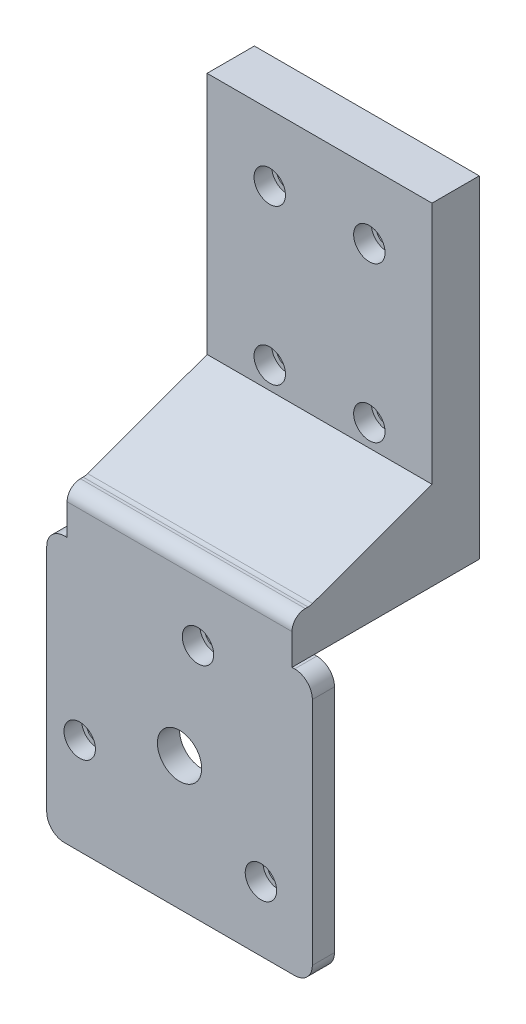
from build123d import *

# Parameters (mm, degrees)
SKETCH1_W           = 50.8
SKETCH1_H           = 65.000000038
SKETCH1_R           = 2.5
EXTRUDE_5_DEPTH     = 7.5
SKETCH1_3_W         = 50.8
SKETCH1_3_H         = 10
BOSS_EXTRUDE1_DEPTH = 34.125
BOSS_EXTRUDE2_START = 34.125
BOSS_EXTRUDE2_DEPTH = 5
CHAMFER1_SIZE       = 10
CHAMFER1_SIZE2      = 27.474774195
FILLET1_R           = 3
SKETCH2_R           = 5
CUT_EXTRUDE1_DEPTH  = 144.721138443
SKETCH3_R           = 2.5
CUT_EXTRUDE2_DEPTH  = 144.721138443
SKETCH4_R           = 3.55
CUT_EXTRUDE3_DEPTH  = 4
SKETCH5_R           = 3.55
CUT_EXTRUDE4_DEPTH  = 4
BOSS_EXTRUDE3_START = -3.18
SKETCH1_5_W         = 50.8
SKETCH1_5_H         = 10
SKETCH1_5_H_2       = 65.000000038
SKETCH1_5_R         = 2.5
BOSS_EXTRUDE3_DEPTH = 3.18


with BuildPart() as part:
    # Sketch1 → 5 (new body)
    with BuildSketch(Plane.XY):
        with Locations((0, 102.500000019)):
            Rectangle(SKETCH1_W, SKETCH1_H)
        with Locations((-11.25, 85.000000038)):
            Circle(SKETCH1_R, mode=Mode.SUBTRACT)
        with Locations((-11.25, 120.000000038)):
            Circle(SKETCH1_R, mode=Mode.SUBTRACT)
        with Locations((11.25, 85.000000038)):
            Circle(SKETCH1_R, mode=Mode.SUBTRACT)
        with Locations((11.25, 120.000000038)):
            Circle(SKETCH1_R, mode=Mode.SUBTRACT)
    extrude(amount=EXTRUDE_5_DEPTH)

    # Sketch1<3> → Boss-Extrude1 (add)
    with BuildSketch(Plane.XY):
        with Locations((0, 65)):
            Rectangle(SKETCH1_3_W, SKETCH1_3_H)
    extrude(amount=BOSS_EXTRUDE1_DEPTH)

    # Sketch1<4> → Boss-Extrude2 (add)
    with BuildSketch(Plane.XY.offset(BOSS_EXTRUDE2_START)):
        with BuildLine():
            Line((-25.4, 70), (-25.4, 60))
            Line((-25.4, 60), (-26, 60))
            ThreePointArc((-26, 60), (-28.828427125, 58.828427125), (-30, 56))
            Line((-30, 56), (-30, 4))
            ThreePointArc((-30, 4), (-28.828427125, 1.171572875), (-26, 0))
            Line((-26, 0), (26, 0))
            ThreePointArc((26, 0), (28.828427125, 1.171572875), (30, 4))
            Line((30, 4), (30, 56))
            ThreePointArc((30, 56), (28.828427125, 58.828427125), (26, 60))
            Line((26, 60), (25.4, 60))
            Line((25.4, 60), (25.4, 70))
            Line((25.4, 70), (-25.4, 70))
        make_face()
    extrude(amount=BOSS_EXTRUDE2_DEPTH)

    # Chamfer1
    chamfer1_edges = [part.edges().sort_by_distance(p)[0] for p in [
        (0, 70, 7.5),
    ]]
    chamfer1_side = [part.faces().sort_by_distance(p)[0] for p in [
        (0, 102.500000019, 7.5),
    ]]
    chamfer(chamfer1_edges, length=CHAMFER1_SIZE, length2=CHAMFER1_SIZE2, reference=chamfer1_side[0])

    # Fillet1
    fillet1_edges = [part.edges().sort_by_distance(p)[0] for p in [
        (0, 70, 39.125),
        (0, 70, 34.974774195),
    ]]
    fillet(fillet1_edges, radius=FILLET1_R)

    # Sketch2 → Cut-Extrude1 (cut, through all)
    with BuildSketch(Plane.XY.offset(39.125)):
        with Locations((0, 30)):
            Circle(SKETCH2_R)
    extrude(amount=-CUT_EXTRUDE1_DEPTH, mode=Mode.SUBTRACT)

    # Sketch3 → Cut-Extrude2 (cut, through all)
    with BuildSketch(Plane.XY.offset(39.125)):
        with Locations((-22.552622899, 21.79151656)):
            Circle(SKETCH3_R)
        with Locations((4.167556264, 53.635386072)):
            Circle(SKETCH3_R)
        with Locations((18.385066635, 14.573097368)):
            Circle(SKETCH3_R)
    extrude(amount=-CUT_EXTRUDE2_DEPTH, mode=Mode.SUBTRACT)

    # Sketch4 → Cut-Extrude3 (cut)
    with BuildSketch(Plane.XY.offset(39.125)):
        with Locations((4.167556264, 53.635386072)):
            Circle(SKETCH4_R)
        with Locations((-22.552622899, 21.79151656)):
            Circle(SKETCH4_R)
        with Locations((18.385066635, 14.573097368)):
            Circle(SKETCH4_R)
    extrude(amount=-CUT_EXTRUDE3_DEPTH, mode=Mode.SUBTRACT)

    # Sketch5 → Cut-Extrude4 (cut)
    with BuildSketch(Plane.XY.offset(7.5)):
        with Locations((-11.25, 120.000000038)):
            Circle(SKETCH5_R)
        with Locations((11.25, 120.000000038)):
            Circle(SKETCH5_R)
        with Locations((-11.25, 85.000000038)):
            Circle(SKETCH5_R)
        with Locations((11.25, 85.000000038)):
            Circle(SKETCH5_R)
    extrude(amount=-CUT_EXTRUDE4_DEPTH, mode=Mode.SUBTRACT)

    # Sketch1<5> → Boss-Extrude3 (add)
    # profile 1 of 2: a face of its own
    with BuildSketch(Plane.XY.offset(BOSS_EXTRUDE3_START)):
        with Locations((0, 65)):
            Rectangle(SKETCH1_5_W, SKETCH1_5_H)
    # profile 2 of 2: a face of its own
    with BuildSketch(Plane.XY.offset(BOSS_EXTRUDE3_START)):
        with Locations((0, 102.500000019)):
            Rectangle(SKETCH1_5_W, SKETCH1_5_H_2)
        with Locations((-11.25, 85.000000038)):
            Circle(SKETCH1_5_R, mode=Mode.SUBTRACT)
        with Locations((-11.25, 120.000000038)):
            Circle(SKETCH1_5_R, mode=Mode.SUBTRACT)
        with Locations((11.25, 85.000000038)):
            Circle(SKETCH1_5_R, mode=Mode.SUBTRACT)
        with Locations((11.25, 120.000000038)):
            Circle(SKETCH1_5_R, mode=Mode.SUBTRACT)
    extrude(amount=BOSS_EXTRUDE3_DEPTH)


solid = part.part
